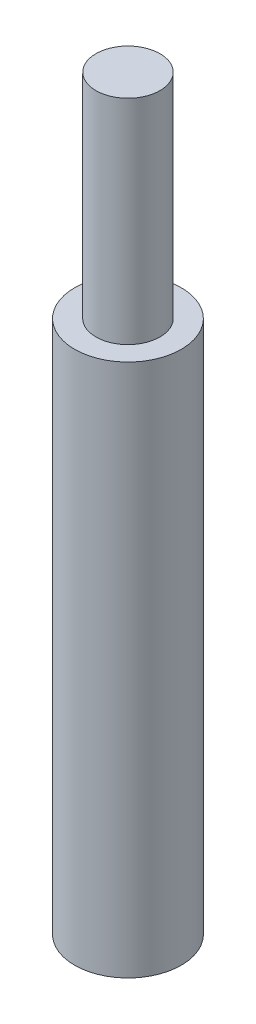
from build123d import *

# Parameters (mm, degrees)
SKETCH1_R           = 2.5
BOSS_EXTRUDE1_DEPTH = 25
SKETCH3_R           = 1.5
BOSS_EXTRUDE2_DEPTH = 10


with BuildPart() as part:
    # Sketch1 → Boss-Extrude1 (new body)
    with BuildSketch(Plane(origin=(0, 0, 0), x_dir=(1, 0, 0), z_dir=(0, 1, 0))):
        with Locations(Location((0, 0, 0), (0, 0, 270))):
            Circle(SKETCH1_R)
    extrude(amount=BOSS_EXTRUDE1_DEPTH)

    # Sketch3 → Boss-Extrude2 (add)
    with BuildSketch(Plane(origin=(0, 25, 0), x_dir=(1, 0, 0), z_dir=(0, 1, 0))):
        with Locations(Location((0, 0, 0), (0, 0, 270))):
            Circle(SKETCH3_R)
    extrude(amount=BOSS_EXTRUDE2_DEPTH)


solid = part.part
